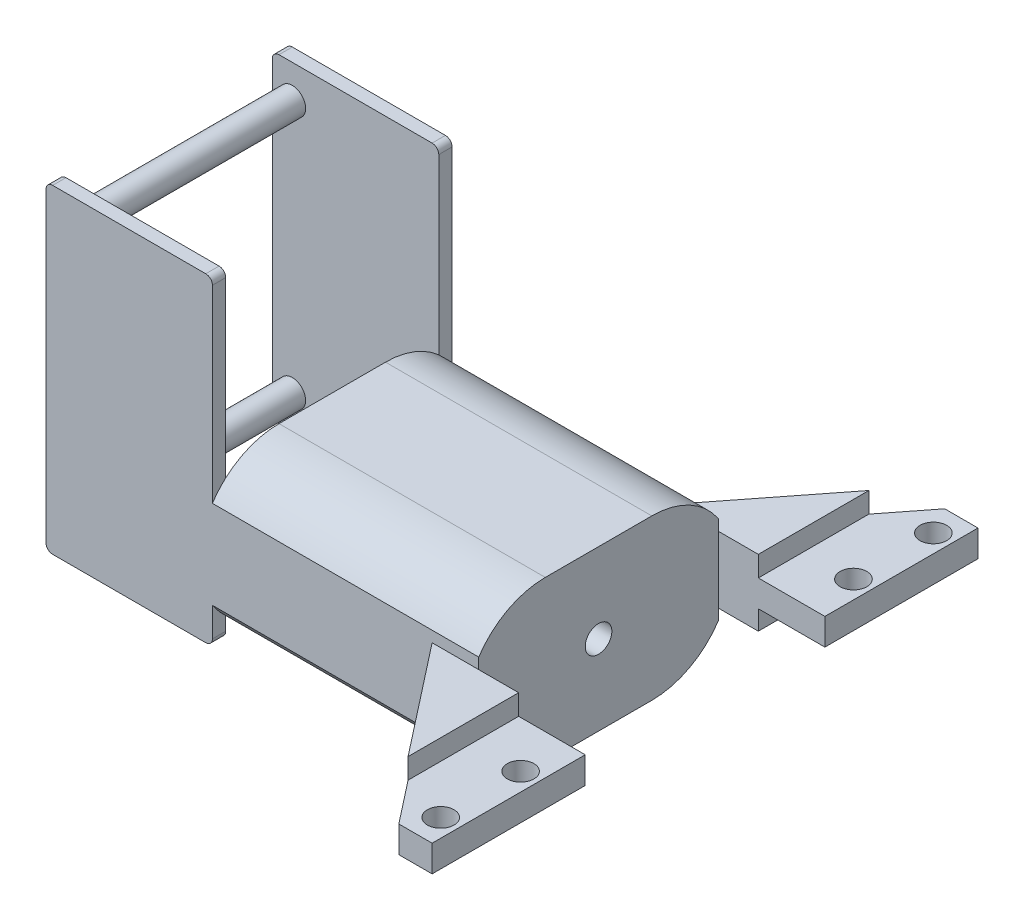
from build123d import *

# Parameters (mm, degrees)
ESQUISSE1_W             = 25
ESQUISSE1_H             = 48
BOSS_EXTRU_1_DEPTH      = 2
ESQUISSE2_R             = 2
BOSS_EXTRU_2_DEPTH      = 32
ESQUISSE3_W             = 25
ESQUISSE3_H             = 48
BOSS_EXTRU_3_DEPTH      = 2
ESQUISSE5_W             = 36
ESQUISSE5_H             = 24
BOSS_EXTRU_4_DEPTH      = 40
ESQUISSE6_R             = 2
ENL_V_MAT_EXTRU_1_DEPTH = 10
ENL_V_MAT_EXTRU_2_DEPTH = 40
ESQUISSE9_W             = 23
ESQUISSE9_H             = 10
BOSS_EXTRU_5_DEPTH      = 23
ESQUISSE10_R            = 2
ENL_V_MAT_EXTRU_3_DEPTH = 23
ESQUISSE11_W            = 23
ESQUISSE11_H            = 10
BOSS_EXTRU_6_DEPTH      = 23
ESQUISSE13_R            = 2
ENL_V_MAT_EXTRU_4_DEPTH = 23
ENL_V_MAT_EXTRU_5_DEPTH = 23
ESQUISSE15_W            = 82
ESQUISSE15_H            = 3.074752109
ESQUISSE15_H_2          = 2.925247891
ENL_V_MAT_EXTRU_6_DEPTH = 10
CONG_1_R                = 1
CONG_2_R                = 1


with BuildPart() as part:
    # Esquisse1 → Boss.-Extru.1 (new body)
    with BuildSketch(Plane.XY):
        with Locations((12.5, 24)):
            Rectangle(ESQUISSE1_W, ESQUISSE1_H)
    extrude(amount=BOSS_EXTRU_1_DEPTH)

    # Esquisse2 → Boss.-Extru.2 (add)
    with BuildSketch(Plane(origin=(0, 0, 0), x_dir=(-1, 0, 0), z_dir=(0, 0, -1))):
        with Locations((-3, 5)):
            Circle(ESQUISSE2_R)
        with Locations((-3, 43)):
            Circle(ESQUISSE2_R)
    extrude(amount=BOSS_EXTRU_2_DEPTH)

    # Esquisse3 → Boss.-Extru.3 (add)
    with BuildSketch(Plane(origin=(0, 0, -32), x_dir=(-1, 0, 0), z_dir=(0, 0, -1))):
        with Locations((-12.5, 24)):
            Rectangle(ESQUISSE3_W, ESQUISSE3_H)
    extrude(amount=BOSS_EXTRU_3_DEPTH)

    # Esquisse5 → Boss.-Extru.4 (add)
    with BuildSketch(Plane(origin=(25, 0, 0), x_dir=(0, 0, -1), z_dir=(1, 0, 0))):
        with Locations((16, 12)):
            Rectangle(ESQUISSE5_W, ESQUISSE5_H)
    extrude(amount=BOSS_EXTRU_4_DEPTH)

    # Esquisse6 → Enlèv. mat.-Extru.1 (cut)
    with BuildSketch(Plane(origin=(65, 0, 0), x_dir=(0, 0, -1), z_dir=(1, 0, 0))):
        with Locations((16, 12)):
            Circle(ESQUISSE6_R)
    extrude(amount=-ENL_V_MAT_EXTRU_1_DEPTH, mode=Mode.SUBTRACT)

    # Esquisse7 → Enlèv. mat.-Extru.2 (cut)
    with BuildSketch(Plane(origin=(65, 0, 0), x_dir=(0, 0, -1), z_dir=(1, 0, 0))):
        with BuildLine():
            Line((8, 24), (8, 33.499215261))
            Line((8, 33.499215261), (-16.874865577, 33.499215261))
            Line((-16.874865577, 33.499215261), (-16.874865577, 0))
            Line((-16.874865577, 0), (8, 0))
            ThreePointArc((8, 0), (-4, 12), (8, 24))
        make_face()
        with BuildLine():
            Line((24, 24), (24, 33.499215261))
            Line((24, 33.499215261), (42.8283548, 33.499215261))
            Line((42.8283548, 33.499215261), (42.8283548, 0))
            Line((42.8283548, 0), (24, 0))
            ThreePointArc((24, 0), (36, 12), (24, 24))
        make_face()
    extrude(amount=-ENL_V_MAT_EXTRU_2_DEPTH, mode=Mode.SUBTRACT)

    # Esquisse9 → Boss.-Extru.5 (add)
    with BuildSketch(Plane.XY.offset(2)):
        with Locations((69.5, 12)):
            Rectangle(ESQUISSE9_W, ESQUISSE9_H)
    extrude(amount=BOSS_EXTRU_5_DEPTH)

    # Esquisse10 → Enlèv. mat.-Extru.3 (cut)
    with BuildSketch(Plane(origin=(0, 17, 0), x_dir=(1, 0, 0), z_dir=(0, 1, 0))):
        with Locations(Location((78.293015344, -21, 0), (0, 0, 270))):
            Circle(ESQUISSE10_R)
        with Locations(Location((78.293015344, -9, 0), (0, 0, 270))):
            Circle(ESQUISSE10_R)
    extrude(amount=-ENL_V_MAT_EXTRU_3_DEPTH, mode=Mode.SUBTRACT)

    # Esquisse11 → Boss.-Extru.6 (add)
    with BuildSketch(Plane(origin=(0, 0, -34), x_dir=(-1, 0, 0), z_dir=(0, 0, -1))):
        with Locations((-69.5, 12)):
            Rectangle(ESQUISSE11_W, ESQUISSE11_H)
    extrude(amount=BOSS_EXTRU_6_DEPTH)

    # Esquisse13 → Enlèv. mat.-Extru.4 (cut)
    with BuildSketch(Plane(origin=(0, 17, 0), x_dir=(1, 0, 0), z_dir=(0, 1, 0))):
        with Locations(Location((78.293015344, 41, 0), (0, 0, 180))):
            Circle(ESQUISSE13_R)
        with Locations(Location((78.293015344, 53, 0), (0, 0, 180))):
            Circle(ESQUISSE13_R)
    extrude(amount=-ENL_V_MAT_EXTRU_4_DEPTH, mode=Mode.SUBTRACT)

    # Esquisse14 → Enlèv. mat.-Extru.5 (cut)
    with BuildSketch(Plane(origin=(0, 17, 0), x_dir=(1, 0, 0), z_dir=(0, 1, 0))):
        Polygon((58, 34), (76, 57), (58, 57), align=None)
        Polygon((58, -2), (76, -25), (58, -25), align=None)
    extrude(amount=-ENL_V_MAT_EXTRU_5_DEPTH, mode=Mode.SUBTRACT)

    # Esquisse15 → Enlèv. mat.-Extru.6 (cut)
    with BuildSketch(Plane(origin=(81, 0, 0), x_dir=(0, 0, -1), z_dir=(1, 0, 0))):
        with Locations((16, 15.462623946)):
            Rectangle(ESQUISSE15_W, ESQUISSE15_H)
        with Locations((16, 8.462623946)):
            Rectangle(ESQUISSE15_W, ESQUISSE15_H_2)
    extrude(amount=-ENL_V_MAT_EXTRU_6_DEPTH, mode=Mode.SUBTRACT)

    # Congé1
    cong_1_edges = [part.edges().sort_by_distance(p)[0] for p in [
        (25, 0, 1),
        (0, 48, 1),
        (25, 48, 1),
        (0, 0, 1),
    ]]
    fillet(cong_1_edges, radius=CONG_1_R)

    # Congé2
    cong_2_edges = [part.edges().sort_by_distance(p)[0] for p in [
        (0, 0, -33),
        (0, 48, -33),
        (25, 48, -33),
        (25, 0, -33),
    ]]
    fillet(cong_2_edges, radius=CONG_2_R)


solid = part.part
